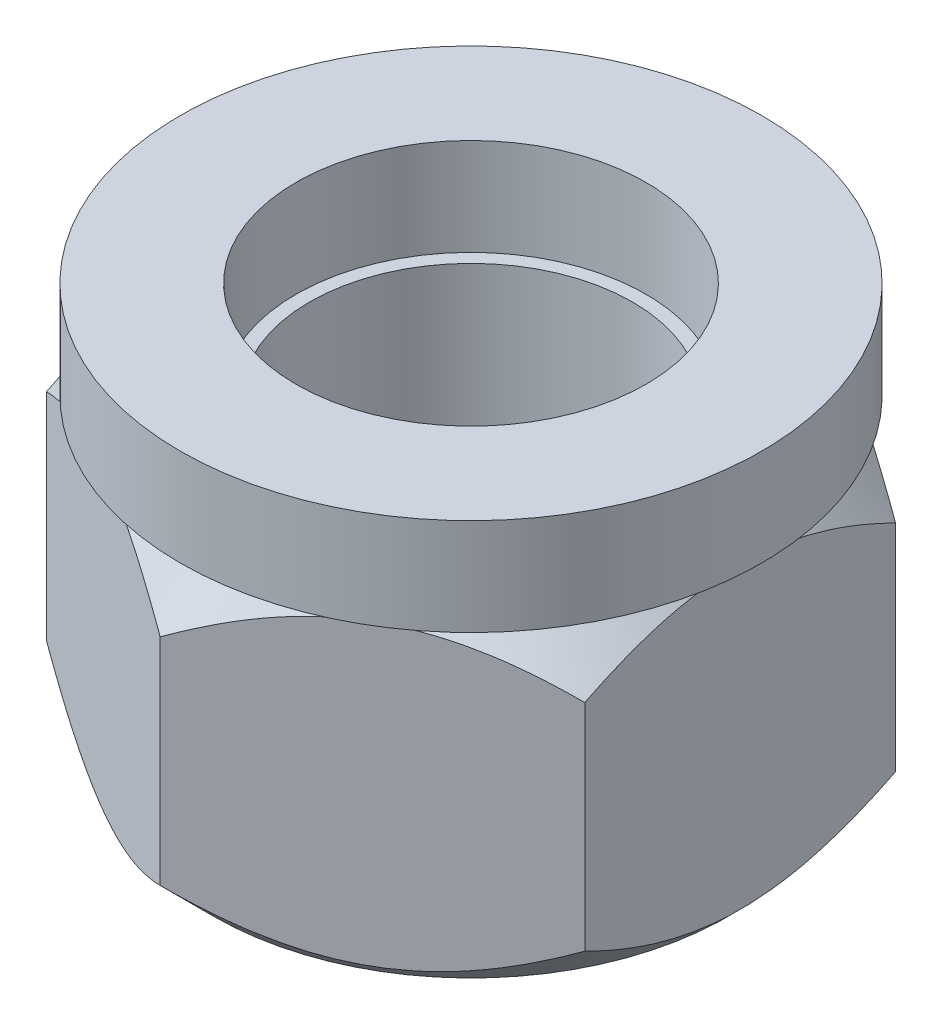
from build123d import *

# Parameters (mm, degrees)
SZKIC1_R                    = 3
DODANIE_WYCI_GNI_CIE1_DEPTH = 3
SZKIC4_R                    = 5.4
SZKIC4_R_2                  = 3.25
DODANIE_WYCI_GNI_CIE2_DEPTH = 1.8


with BuildPart() as part:
    # Szkic1 → Dodanie-wyciągnięcie1 (new, symmetric)
    with BuildSketch(Plane(origin=(0, 0, 0), x_dir=(1, 0, 0), z_dir=(0, 1, 0))):
        Polygon((5, -2.886751346), (5, 2.886751346), (0, 5.773502692), (-5, 2.886751346), (-5, -2.886751346), (0, -5.773502692), align=None)
        with Locations(Location((0, 0, 0), (0, 0, 270))):
            Circle(SZKIC1_R, mode=Mode.SUBTRACT)
    extrude(amount=DODANIE_WYCI_GNI_CIE1_DEPTH, both=True)

    # Szkic3 → Wycięcie-obrót9 (revolve, cut)
    with BuildSketch(Plane(origin=(0, 0, 0), x_dir=(0, 0, -1), z_dir=(1, 0, 0)), mode=Mode.PRIVATE) as wyci_cie_obr_t9_sk:
        Polygon((5.773502692, 3), (5.773502692, 2), (4.773502692, 3), align=None)
        Polygon((4.773502692, -3), (5.773502692, -3), (5.773502692, -2), align=None)
    revolve(wyci_cie_obr_t9_sk.sketch.rotate(Axis((0, 0, 0), (0, 1, 0)), 180), axis=Axis((0, 0, 0), (0, 1, 0)), mode=Mode.SUBTRACT)

    # Szkic4 → Dodanie-wyciągnięcie2 (add)
    with BuildSketch(Plane(origin=(0, 3, 0), x_dir=(1, 0, 0), z_dir=(0, 1, 0))):
        with Locations(Location((0, 0, 0), (0, 0, 270))):
            Circle(SZKIC4_R)
        with Locations(Location((0, 0, 0), (0, 0, 270))):
            Circle(SZKIC4_R_2, mode=Mode.SUBTRACT)
    extrude(amount=DODANIE_WYCI_GNI_CIE2_DEPTH)


solid = part.part
